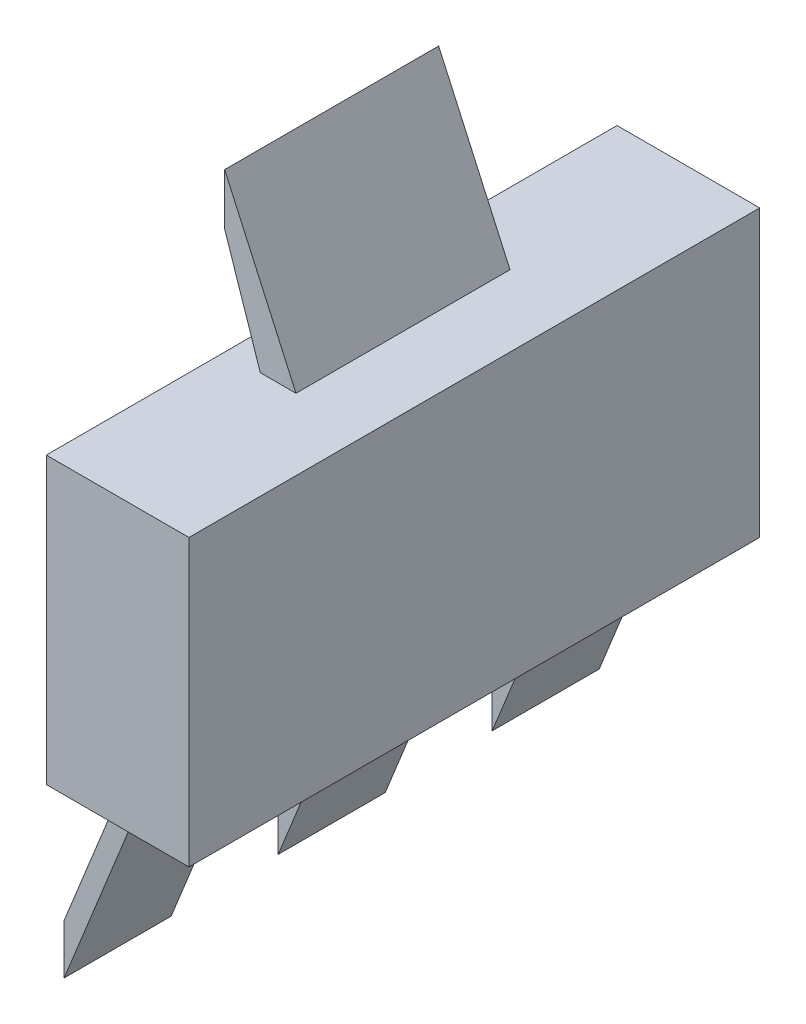
from build123d import *

# Parameters (mm, degrees)
SKETCH_1_W                 = 8
SKETCH_1_H                 = 4
EXTRUDE_1_DEPTH            = 2
EXTRUDE_2_DEPTH            = 1.5
EXTRUDE_3_DEPTH            = 0.75
PATTERN_LINEAR_1_COUNT     = 2
PATTERN_LINEAR_1_PITCH     = 3
PATTERN_LINEAR_1_COL_COUNT = 2
PATTERN_LINEAR_1_COL_PITCH = 3


with BuildPart() as part:
    # 草图1 → 凸台-拉伸1 (new body)
    with BuildSketch(Plane(origin=(0, 0, 0), x_dir=(0, 0, -1), z_dir=(1, 0, 0))):
        Rectangle(SKETCH_1_W, SKETCH_1_H)
    extrude(amount=EXTRUDE_1_DEPTH)

    # 草图2 → 凸台-拉伸2 (add, symmetric)
    with BuildSketch(Plane.XY):
        Polygon((1, 2), (0, 4.215421364), (0, 3.49328806), (0.5, 2), align=None)
    extrude(amount=EXTRUDE_2_DEPTH, both=True)

    # 草图3 → 凸台-拉伸3 (add, symmetric)
    with BuildSketch(Plane.XY):
        Polygon((1, -2), (0, -4.472901544), (0, -3.77481073), (0.717703758, -2), align=None)
    extrude_3 = extrude(amount=EXTRUDE_3_DEPTH, both=True)

    # 阵列(线性)1: 凸台-拉伸3 ×2
    with Locations(*[(0, 0, i * PATTERN_LINEAR_1_PITCH) for i in range(1, PATTERN_LINEAR_1_COUNT)]):
        add(extrude_3)

    # 阵列(线性)1 col: 凸台-拉伸3 ×2
    with Locations(*[(0, 0, -i * PATTERN_LINEAR_1_COL_PITCH) for i in range(1, PATTERN_LINEAR_1_COL_COUNT)]):
        add(extrude_3)


solid = part.part
